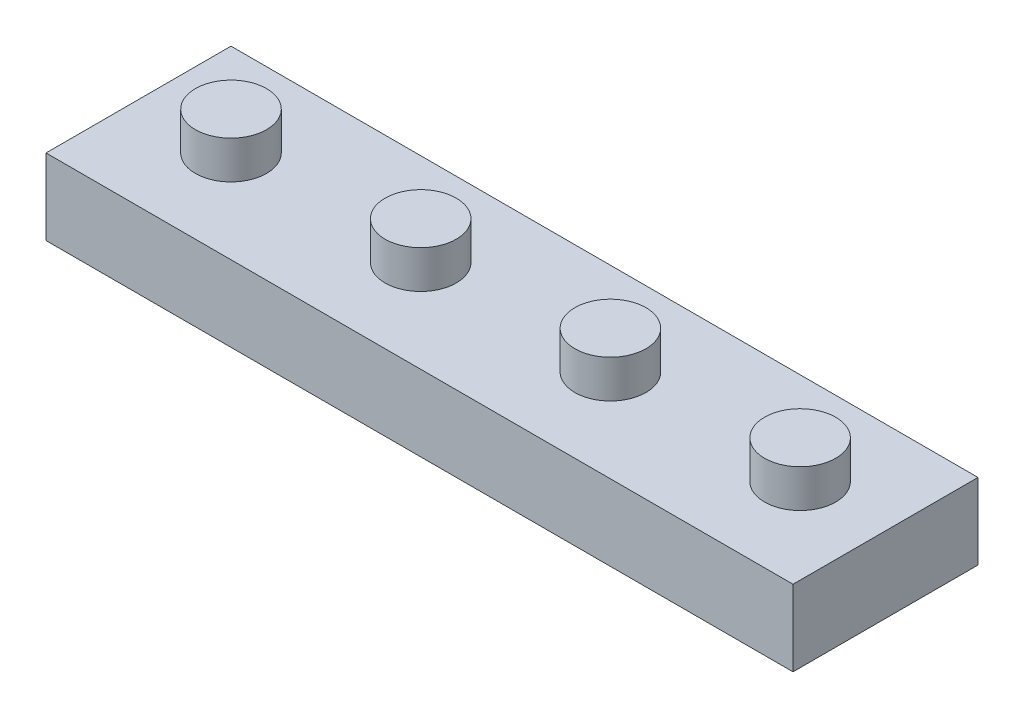
from build123d import *

# Parameters (mm, degrees)
SKETCH1_W            = 31.5
SKETCH1_H            = 3.2
BOSS_EXTRUDE1_DEPTH  = 7.8
SKETCH2_R            = 1.5
BOSS_EXTRUDE2_DEPTH  = 1.6
LPATTERN1_COUNT      = 2
LPATTERN1_PITCH      = 8
LPATTERN1_COUNT_DIR2 = 4
LPATTERN1_PITCH_DIR2 = 8
SHELL1_T             = -1.2
SKETCH3_R            = 1.5
SKETCH3_R_2          = 0.6
BOSS_EXTRUDE3_DEPTH  = 1.8
LPATTERN2_COUNT      = 3
LPATTERN2_PITCH      = 8


with BuildPart() as part:
    # Sketch1 → Boss-Extrude1 (new body)
    with BuildSketch(Plane.XY):
        with Locations((15.75, 1.6)):
            Rectangle(SKETCH1_W, SKETCH1_H)
    extrude(amount=-BOSS_EXTRUDE1_DEPTH)

    # Sketch2 → Boss-Extrude2 (add)
    with BuildSketch(Plane(origin=(0, 3.2, 0), x_dir=(1, 0, 0), z_dir=(0, 1, 0))):
        with Locations(Location((3.9, 3.9, 0), (0, 0, 270))):
            Circle(SKETCH2_R)
    boss_extrude2 = extrude(amount=BOSS_EXTRUDE2_DEPTH)

    # LPattern1: Boss-Extrude2 2 × 4, 4 skipped
    with Locations(*[(j * LPATTERN1_PITCH_DIR2, 0, i * LPATTERN1_PITCH) for i in range(LPATTERN1_COUNT) for j in range(LPATTERN1_COUNT_DIR2) if (i, j) not in ((0, 0), (1, 0), (1, 1), (1, 2), (1, 3))]):
        add(boss_extrude2)

    # Shell1
    shell1_openings = [part.faces().sort_by_distance(p)[0] for p in [
        (15.75, 0, -3.9),
    ]]
    offset(amount=SHELL1_T, openings=shell1_openings, kind=Kind.INTERSECTION)

    # Sketch3 → Boss-Extrude3 (add)
    with BuildSketch(Plane.XZ.offset(-2)):
        with Locations(Location((7.9, -3.9, 0), (0, 0, 90))):
            Circle(SKETCH3_R)
        with Locations(Location((7.9, -3.9, 0), (0, 0, 270))):
            Circle(SKETCH3_R_2, mode=Mode.SUBTRACT)
    boss_extrude3 = extrude(amount=BOSS_EXTRUDE3_DEPTH)

    # LPattern2: Boss-Extrude3 ×3
    with Locations(*[(i * LPATTERN2_PITCH, 0, 0) for i in range(1, LPATTERN2_COUNT)]):
        add(boss_extrude3)


solid = part.part
